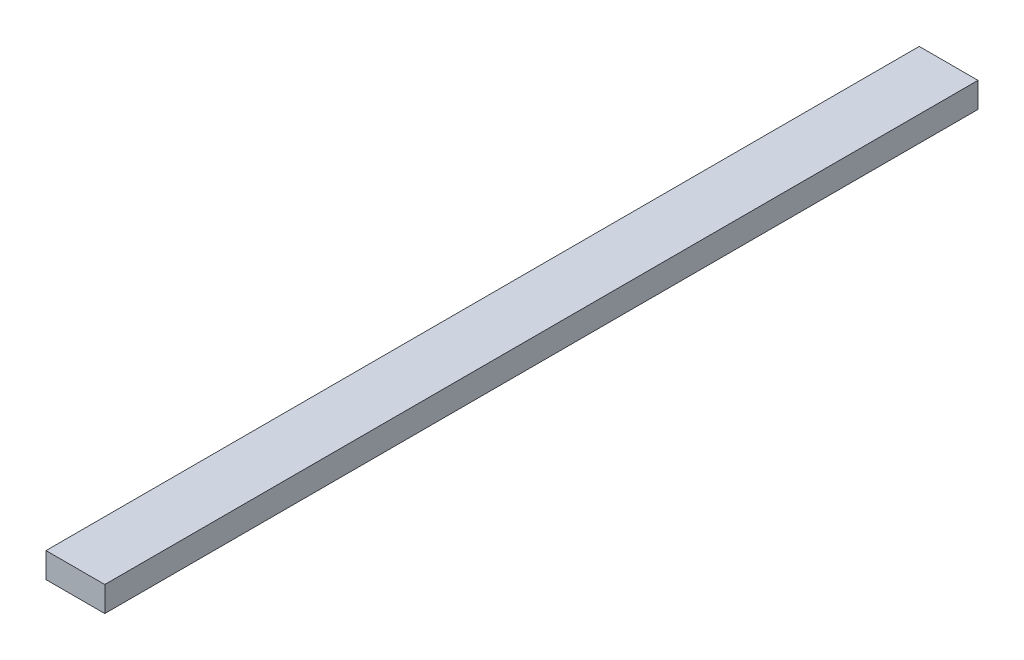
from build123d import *

# Parameters (mm, degrees)
SKETCH1_W           = 88.9
SKETCH1_H           = 38.1
BOSS_EXTRUDE1_DEPTH = 660.4


with BuildPart() as part:
    # Sketch1 → Boss-Extrude1 (new, symmetric)
    with BuildSketch(Plane.XY):
        Rectangle(SKETCH1_W, SKETCH1_H)
    extrude(amount=BOSS_EXTRUDE1_DEPTH, both=True)


solid = part.part
